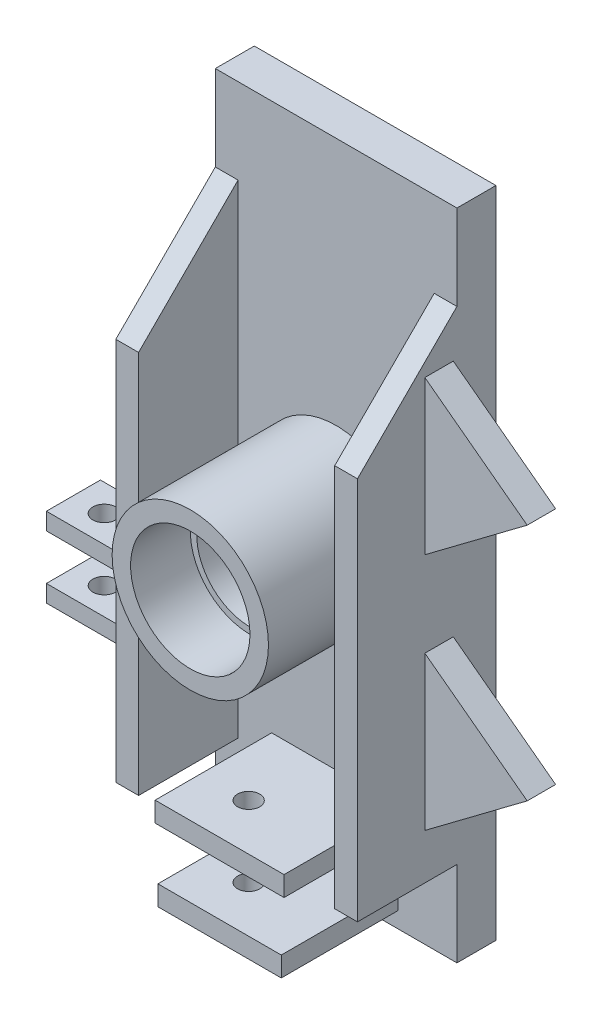
from build123d import *

# Parameters (mm, degrees)
SKETCH2_R           = 27.5
BOSS_EXTRUDE1_DEPTH = 65.024
SKETCH3_W           = 85
SKETCH3_H           = 230
BOSS_EXTRUDE2_DEPTH = 13.716
SKETCH4_W           = 43.394113748
SKETCH4_H           = 7
SKETCH4_W_2         = 45.361068276
BOSS_EXTRUDE3_DEPTH = 41
SKETCH7_R           = 18.75
CUT_EXTRUDE3_DEPTH  = 65.024
SKETCH5_R           = 21
CUT_EXTRUDE1_DEPTH  = 21
SKETCH6_R           = 23.5
CUT_EXTRUDE2_DEPTH  = 15
CUT_EXTRUDE4_START  = -25
SKETCH8_R           = 21
CUT_EXTRUDE4_DEPTH  = 25
SKETCH10_W          = 8
SKETCH10_H          = 170
BOSS_EXTRUDE4_DEPTH = 35
CUT_EXTRUDE5_REACH  = 159.093
CUT_EXTRUDE6_REACH  = 209.583
SKETCH14_R          = 3.898215838
BOSS_EXTRUDE5_START = 15
BOSS_EXTRUDE5_DEPTH = 10
SKETCH21_W          = 19
SKETCH21_H          = 6
BOSS_EXTRUDE6_DEPTH = 38
CUT_EXTRUDE7_REACH  = 178.644
SKETCH22_R          = 4


with BuildPart() as part:
    # Sketch2 → Boss-Extrude1 (new body)
    with BuildSketch(Plane.XY):
        Circle(SKETCH2_R)
    extrude(amount=BOSS_EXTRUDE1_DEPTH)

    # Sketch3 → Boss-Extrude2 (add)
    with BuildSketch(Plane.XY):
        Rectangle(SKETCH3_W, SKETCH3_H)
    extrude(amount=BOSS_EXTRUDE2_DEPTH)

    # Sketch4 → Boss-Extrude3 (add)
    with BuildSketch(Plane.XY.offset(13.716)):
        with Locations((0, -106)):
            Rectangle(SKETCH4_W, SKETCH4_H)
        with Locations((0, -81)):
            Rectangle(SKETCH4_W_2, SKETCH4_H)
    extrude(amount=BOSS_EXTRUDE3_DEPTH)

    # Sketch7 → Cut-Extrude3 (cut)
    with BuildSketch(Plane.XY.offset(65.024)):
        Circle(SKETCH7_R)
    extrude(amount=-CUT_EXTRUDE3_DEPTH, mode=Mode.SUBTRACT)

    # Sketch5 → Cut-Extrude1 (cut)
    with BuildSketch(Plane.XY.offset(65.024)):
        Circle(SKETCH5_R)
    extrude(amount=-CUT_EXTRUDE1_DEPTH, mode=Mode.SUBTRACT)

    # Sketch6 → Cut-Extrude2 (cut)
    with BuildSketch(Plane(origin=(0, 0, 0), x_dir=(-1, 0, 0), z_dir=(0, 0, -1))):
        Circle(SKETCH6_R)
    extrude(amount=-CUT_EXTRUDE2_DEPTH, mode=Mode.SUBTRACT)

    # Sketch8 → Cut-Extrude4 (cut)
    with BuildSketch(Plane(origin=(0, 0, 0), x_dir=(-1, 0, 0), z_dir=(0, 0, -1)).offset(CUT_EXTRUDE4_START)):
        with Locations(Location((0, 0, 0), (0, 0, 180))):
            Circle(SKETCH8_R)
    extrude(amount=CUT_EXTRUDE4_DEPTH, mode=Mode.SUBTRACT)

    # Sketch10 → Boss-Extrude4 (add)
    with BuildSketch(Plane.XY.offset(13.716)):
        with Locations((-38.5, 0)):
            Rectangle(SKETCH10_W, SKETCH10_H)
        with Locations((38.5, 0)):
            Rectangle(SKETCH10_W, SKETCH10_H)
    extrude(amount=BOSS_EXTRUDE4_DEPTH)

    # Cut-Extrude5: up to this face of the body (flat: up to its plane)
    cut_extrude5_end = Plane(part.part.faces().sort_by_distance((42.5, 0, 22.776198113))[0])
    # Sketch11 → Cut-Extrude5 (cut, up to the picked face)
    with BuildSketch(Plane.ZY.offset(42.5), mode=Mode.PRIVATE) as cut_extrude5_sk1:
        Polygon((13.716, 85), (48.716, 50), (48.716, 85), align=None)
    cut_extrude5_tool1 = split(extrude(cut_extrude5_sk1.sketch, amount=-CUT_EXTRUDE5_REACH, mode=Mode.PRIVATE), bisect_by=cut_extrude5_end, keep=Keep.BOTH, mode=Mode.PRIVATE)
    add(cut_extrude5_tool1.solids().sort_by(Axis((-42.5, 73.333333, 37.049333), (1, 0, 0)))[0], mode=Mode.SUBTRACT)

    # Cut-Extrude6: up to this face of the body (flat: up to its plane)
    cut_extrude6_end = Plane(part.part.faces().sort_by_distance((0, -109.5, 34.216))[0])
    # Sketch14 → Cut-Extrude6 (cut, up to the picked face)
    with BuildSketch(Plane(origin=(0, -77.5, 0), x_dir=(1, 0, 0), z_dir=(0, 1, 0)), mode=Mode.PRIVATE) as cut_extrude6_sk1:
        with Locations(Location((-6.143911141, -38.35, 0), (0, 0, 270))):
            Circle(SKETCH14_R)
    cut_extrude6_tool1 = split(extrude(cut_extrude6_sk1.sketch, amount=-CUT_EXTRUDE6_REACH, mode=Mode.PRIVATE), bisect_by=cut_extrude6_end, keep=Keep.BOTH, mode=Mode.PRIVATE)
    add(cut_extrude6_tool1.solids().sort_by(Axis((-6.143911, -77.5, 38.35), (0, -1, 0)))[0], mode=Mode.SUBTRACT)

    # Sketch16 → Boss-Extrude5 (add)
    with BuildSketch(Plane.XY.offset(BOSS_EXTRUDE5_START)):
        Polygon((78.5, -42), (42.5, -15), (42.5, -69), align=None)
        Polygon((42.5, 69), (78.5, 42), (42.5, 15), align=None)
    extrude(amount=BOSS_EXTRUDE5_DEPTH)

    # Sketch21 → Boss-Extrude6 (add)
    with BuildSketch(Plane.ZY.offset(42.5)):
        with Locations((25.65, -53.16)):
            Rectangle(SKETCH21_W, SKETCH21_H)
        with Locations((25.65, -31.16)):
            Rectangle(SKETCH21_W, SKETCH21_H)
    extrude(amount=BOSS_EXTRUDE6_DEPTH)

    # Cut-Extrude7: up to this face of the body (flat: up to its plane)
    cut_extrude7_end = Plane(part.part.faces().sort_by_distance((-61.5, -56.16, 25.65))[0])
    # Sketch22 → Cut-Extrude7 (cut, up to the picked face)
    with BuildSketch(Plane(origin=(0, -28.16, 0), x_dir=(1, 0, 0), z_dir=(0, 1, 0)), mode=Mode.PRIVATE) as cut_extrude7_sk1:
        with Locations(Location((-69.643911141, -25.65, 0), (0, 0, 180))):
            Circle(SKETCH22_R)
    cut_extrude7_tool1 = split(extrude(cut_extrude7_sk1.sketch, amount=-CUT_EXTRUDE7_REACH, mode=Mode.PRIVATE), bisect_by=cut_extrude7_end, keep=Keep.BOTH, mode=Mode.PRIVATE)
    add(cut_extrude7_tool1.solids().sort_by(Axis((-69.643911, -28.16, 25.65), (0, -1, 0)))[0], mode=Mode.SUBTRACT)


solid = part.part
